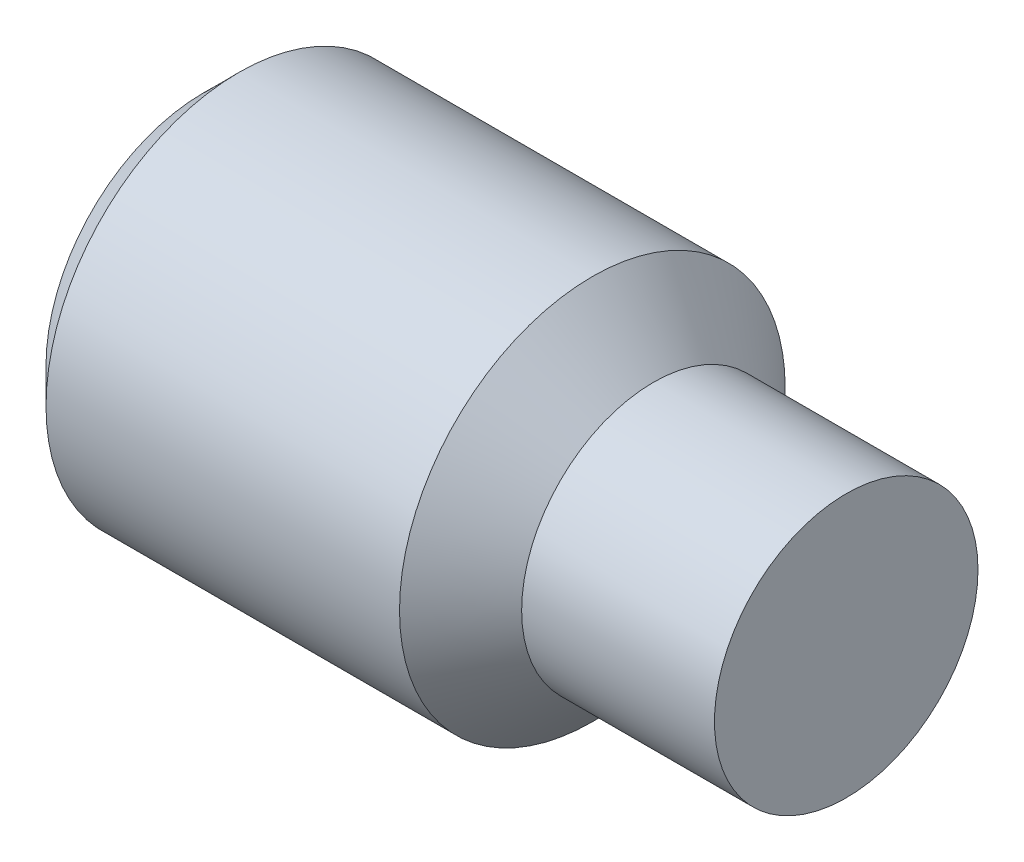
from build123d import *

# Parameters (mm, degrees)
SKETCH_1_R          = 6
EXTRUDE_1_DEPTH     = 20
CUT_EXTRUDE_1_DEPTH = 8
CUT_EXTRUDE_START   = -6
SKETCH_3_R          = 6
SKETCH_3_R_2        = 4.1
CUT_EXTRUDE_2_DEPTH = 6
FILLET_1_R          = 1


with BuildPart() as part:
    # Эскиз1 → Вытянуть1 (new body)
    with BuildSketch(Plane(origin=(0, 0, 0), x_dir=(0, 0, -1), z_dir=(1, 0, 0))):
        Circle(SKETCH_1_R)
    extrude(amount=EXTRUDE_1_DEPTH)

    # Эскиз2 → Вырез-Вытянуть1 (cut)
    with BuildSketch(Plane.ZY):
        Polygon((-3, -1.732050808), (0, -3.464101615), (0, 3.464101615), (-3, 1.732050808), align=None)
        Polygon((0, -3.464101615), (0, 3.464101615), (3, 1.732050808), (3, -1.732050808), align=None)
    extrude(amount=-CUT_EXTRUDE_1_DEPTH, mode=Mode.SUBTRACT)

    # Эскиз3 → Вырез-Вытянуть2 (cut)
    with BuildSketch(Plane(origin=(20, 0, 0), x_dir=(0, 0, -1), z_dir=(1, 0, 0)).offset(CUT_EXTRUDE_START)):
        Circle(SKETCH_3_R)
        Circle(SKETCH_3_R_2, mode=Mode.SUBTRACT)
    extrude(amount=CUT_EXTRUDE_2_DEPTH, mode=Mode.SUBTRACT)

    # Эскиз4 → Вырез-Повернуть1 (revolve, cut)
    with BuildSketch(Plane.XY, mode=Mode.PRIVATE) as cut_revolve_1_sk:
        Polygon((14, 6), (14, 4.1), (12.1, 6), align=None)
    revolve(cut_revolve_1_sk.sketch.rotate(Axis((0, 0, 0), (1, 0, 0)), 90), axis=Axis((0, 0, 0), (1, 0, 0)), mode=Mode.SUBTRACT)

    # Эскиз5 → Вырез-Повернуть2 (revolve, cut)
    with BuildSketch(Plane.XY, mode=Mode.PRIVATE) as cut_revolve_2_sk:
        Polygon((0, 6), (0, 4.9), (1.1, 6), align=None)
    revolve(cut_revolve_2_sk.sketch.rotate(Axis((0, 0, 0), (1, 0, 0)), 90), axis=Axis((0, 0, 0), (1, 0, 0)), mode=Mode.SUBTRACT)

    # Скругление1
    fillet_1_edges = [part.edges().sort_by_distance(p)[0] for p in [
        (8, -2.598076211, 1.5),
        (8, -2.598076211, -1.5),
        (8, 0, -3),
        (8, 2.598076211, -1.5),
        (8, 2.598076211, 1.5),
        (8, 0, 3),
    ]]
    fillet(fillet_1_edges, radius=FILLET_1_R)


solid = part.part
